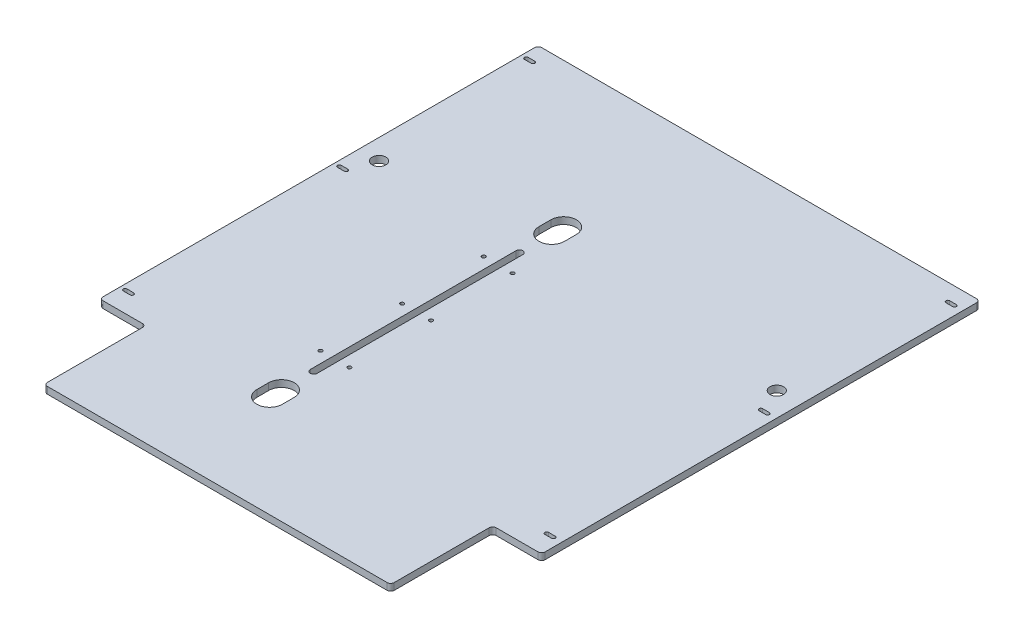
from build123d import *

# Parameters (mm, degrees)
BOSS_EXTRUDE1_DEPTH = 12.7
FILLET1_R           = 6.604
FILLET2_R           = 6.604
SKETCH2_R           = 12.7
CUT_EXTRUDE1_DEPTH  = 1173.069644902
CUT_EXTRUDE3_DEPTH  = 1173.069644902
CUT_EXTRUDE4_DEPTH  = 1173.069644902
SKETCH6_R           = 3.3782
CUT_EXTRUDE5_DEPTH  = 1173.069644902
CUT_EXTRUDE6_DEPTH  = 1173.069644902


with BuildPart() as part:
    # Sketch1 → Boss-Extrude1 (new body)
    with BuildSketch(Plane(origin=(0, 0, 0), x_dir=(1, 0, 0), z_dir=(0, 1, 0))):
        Polygon((0, 0), (96.04375, 0), (96.04375, -190.5), (743.74375, -190.5), (743.74375, 0), (838.2, 0), (838.2, 819.15), (0, 819.15), align=None)
        with BuildLine():
            Line((19.05, 41.4782), (31.75, 41.4782))
            ThreePointArc((31.75, 41.4782), (35.1282, 38.1), (31.75, 34.7218))
            Line((31.75, 34.7218), (19.05, 34.7218))
            ThreePointArc((19.05, 34.7218), (15.6718, 38.1), (19.05, 41.4782))
        make_face(mode=Mode.SUBTRACT)
        with BuildLine():
            Line((19.05, 441.5282), (31.75, 441.5282))
            ThreePointArc((31.75, 441.5282), (35.1282, 438.15), (31.75, 434.7718))
            Line((31.75, 434.7718), (19.05, 434.7718))
            ThreePointArc((19.05, 434.7718), (15.6718, 438.15), (19.05, 441.5282))
        make_face(mode=Mode.SUBTRACT)
        with BuildLine():
            Line((31.75, 784.0218), (19.05, 784.0218))
            ThreePointArc((19.05, 784.0218), (15.6718, 787.4), (19.05, 790.7782))
            Line((19.05, 790.7782), (31.75, 790.7782))
            ThreePointArc((31.75, 790.7782), (35.1282, 787.4), (31.75, 784.0218))
        make_face(mode=Mode.SUBTRACT)
        with BuildLine():
            Line((806.45, 784.0218), (819.15, 784.0218))
            ThreePointArc((819.15, 784.0218), (822.5282, 787.4), (819.15, 790.7782))
            Line((819.15, 790.7782), (806.45, 790.7782))
            ThreePointArc((806.45, 790.7782), (803.0718, 787.4), (806.45, 784.0218))
        make_face(mode=Mode.SUBTRACT)
        with BuildLine():
            Line((819.15, 441.5282), (806.45, 441.5282))
            ThreePointArc((806.45, 441.5282), (803.0718, 438.15), (806.45, 434.7718))
            Line((806.45, 434.7718), (819.15, 434.7718))
            ThreePointArc((819.15, 434.7718), (822.5282, 438.15), (819.15, 441.5282))
        make_face(mode=Mode.SUBTRACT)
        with BuildLine():
            Line((819.15, 41.4782), (806.45, 41.4782))
            ThreePointArc((806.45, 41.4782), (803.0718, 38.1), (806.45, 34.7218))
            Line((806.45, 34.7218), (819.15, 34.7218))
            ThreePointArc((819.15, 34.7218), (822.5282, 38.1), (819.15, 41.4782))
        make_face(mode=Mode.SUBTRACT)
    extrude(amount=BOSS_EXTRUDE1_DEPTH)

    # Fillet1
    fillet1_edges = [part.edges().sort_by_distance(p)[0] for p in [
        (743.74375, 6.35, 0),
        (96.04375, 6.35, 0),
    ]]
    fillet(fillet1_edges, radius=FILLET1_R)

    # Fillet2
    fillet2_edges = [part.edges().sort_by_distance(p)[0] for p in [
        (0, 6.35, -819.15),
        (838.2, 6.35, -819.15),
        (838.2, 6.35, 0),
        (743.74375, 6.35, 190.5),
        (96.04375, 6.35, 190.5),
        (0, 6.35, 0),
    ]]
    fillet(fillet2_edges, radius=FILLET2_R)

    # Sketch2 → Cut-Extrude1 (cut, through all)
    with BuildSketch(Plane(origin=(0, 12.7, 0), x_dir=(1, 0, 0), z_dir=(0, 1, 0))):
        with Locations(Location((47.625, 483.87, 0), (0, 0, 270))):
            Circle(SKETCH2_R)
        with Locations(Location((790.575, 483.87, 0), (0, 0, 270))):
            Circle(SKETCH2_R)
    extrude(amount=-CUT_EXTRUDE1_DEPTH, mode=Mode.SUBTRACT)

    # Sketch4 → Cut-Extrude3 (cut, through all)
    with BuildSketch(Plane.XZ):
        with BuildLine():
            Line((350.8375, -527.05), (350.8375, -549.275))
            ThreePointArc((350.8375, -549.275), (327.025, -573.0875), (303.2125, -549.275))
            Line((303.2125, -549.275), (303.2125, -527.05))
            ThreePointArc((303.2125, -527.05), (327.025, -503.2375), (350.8375, -527.05))
        make_face()
        with BuildLine():
            Line((350.8375, 0), (350.8375, -22.225))
            ThreePointArc((350.8375, -22.225), (327.025, -46.0375), (303.2125, -22.225))
            Line((303.2125, -22.225), (303.2125, 0))
            ThreePointArc((303.2125, 0), (327.025, 23.8125), (350.8375, 0))
        make_face()
    extrude(amount=-CUT_EXTRUDE3_DEPTH, mode=Mode.SUBTRACT)

    # Sketch5 → Cut-Extrude4 (cut, through all)
    with BuildSketch(Plane.XZ):
        with BuildLine():
            Line((320.675, -466.725), (320.675, -82.55))
            ThreePointArc((320.675, -82.55), (327.025, -76.2), (333.375, -82.55))
            Line((333.375, -82.55), (333.375, -466.725))
            ThreePointArc((333.375, -466.725), (327.025, -473.075), (320.675, -466.725))
        make_face()
    extrude(amount=-CUT_EXTRUDE4_DEPTH, mode=Mode.SUBTRACT)

    # Sketch6 → Cut-Extrude5 (cut, through all)
    with BuildSketch(Plane.XZ):
        with Locations(Location((354.0125, -274.6375, 0), (0, 0, 270))):
            Circle(SKETCH6_R)
        with Locations(Location((354.0125, -427.0375, 0), (0, 0, 270))):
            Circle(SKETCH6_R)
        with Locations(Location((354.0125, -122.2375, 0), (0, 0, 90))):
            Circle(SKETCH6_R)
        with Locations(Location((300.0375, -427.0375, 0), (0, 0, 90))):
            Circle(SKETCH6_R)
        with Locations(Location((300.0375, -274.6375, 0), (0, 0, 90))):
            Circle(SKETCH6_R)
        with Locations(Location((300.0375, -122.2375, 0), (0, 0, 270))):
            Circle(SKETCH6_R)
    extrude(amount=-CUT_EXTRUDE5_DEPTH, mode=Mode.SUBTRACT)

    # Sketch7 → Cut-Extrude6 (cut, through all)
    with BuildSketch(Plane.XZ):
        with BuildLine():
            ThreePointArc((828.421, -819.15), (833.090733183, -817.215733183), (835.025, -812.546))
            Line((835.025, -812.546), (835.025, -6.604))
            ThreePointArc((835.025, -6.604), (833.090733183, -1.934266817), (828.421, 0))
            Line((828.421, 0), (831.596, 0))
            ThreePointArc((831.596, 0), (836.265733183, -1.934266817), (838.2, -6.604))
            Line((838.2, -6.604), (838.2, -812.546))
            ThreePointArc((838.2, -812.546), (836.265733183, -817.215733183), (831.596, -819.15))
            Line((831.596, -819.15), (828.421, -819.15))
        make_face()
        with BuildLine():
            ThreePointArc((9.525, -812.546), (11.459266817, -817.215733183), (16.129, -819.15))
            Line((16.129, -819.15), (6.604, -819.15))
            ThreePointArc((6.604, -819.15), (1.934266817, -817.215733183), (0, -812.546))
            Line((0, -812.546), (0, -6.604))
            ThreePointArc((0, -6.604), (1.934266817, -1.934266817), (6.604, 0))
            Line((6.604, 0), (16.129, 0))
            ThreePointArc((16.129, 0), (11.459266817, -1.934266817), (9.525, -6.604))
            Line((9.525, -6.604), (9.525, -812.546))
        make_face()
    extrude(amount=-CUT_EXTRUDE6_DEPTH, mode=Mode.SUBTRACT)


solid = part.part
